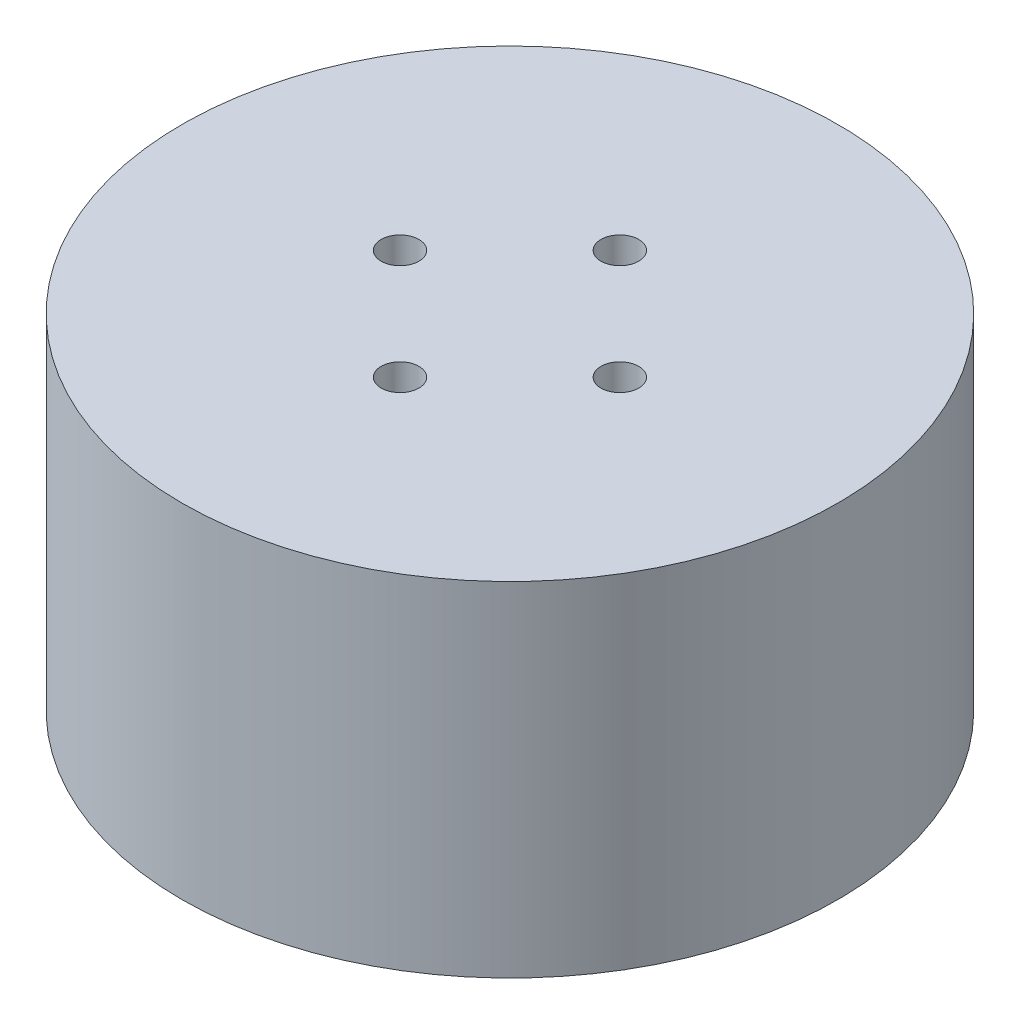
from build123d import *

# Parameters (mm, degrees)
ESQUISSE1_R              = 47.75
BOSS_EXTRU_1_DEPTH       = 50
ESQUISSE2_R              = 26
ENL_V_MAT_EXTRU_1_DEPTH  = 20
ESQUISSE3_R              = 11
ENL_V_MAT_EXTRU_5_DEPTH  = 7.5
ESQUISSE4_R              = 5
ENL_V_MAT_EXTRU_6_DEPTH  = 13.5
ESQUISSE11_R             = 2.75
ENL_V_MAT_EXTRU_11_DEPTH = 85.024549984


with BuildPart() as part:
    # Esquisse1 → Boss.-Extru.1 (new body)
    with BuildSketch(Plane(origin=(0, 0, 0), x_dir=(1, 0, 0), z_dir=(0, 1, 0))):
        with Locations(Location((0, 0, 0), (0, 0, 270))):
            Circle(ESQUISSE1_R)
    extrude(amount=BOSS_EXTRU_1_DEPTH)

    # Esquisse2 → Enlèv. mat.-Extru.1 (cut)
    with BuildSketch(Plane(origin=(0, 0, 0), x_dir=(-1, 0, 0), z_dir=(0, -1, 0))):
        with Locations(Location((0, 0, 0), (0, 0, 90))):
            Circle(ESQUISSE2_R)
    extrude(amount=-ENL_V_MAT_EXTRU_1_DEPTH, mode=Mode.SUBTRACT)

    # Esquisse3 → Enlèv. mat.-Extru.5 (cut)
    with BuildSketch(Plane(origin=(0, 20, 0), x_dir=(-1, 0, 0), z_dir=(0, -1, 0))):
        with Locations(Location((0, 0, 0), (0, 0, 90))):
            Circle(ESQUISSE3_R)
    extrude(amount=-ENL_V_MAT_EXTRU_5_DEPTH, mode=Mode.SUBTRACT)

    # Esquisse4 → Enlèv. mat.-Extru.6 (cut)
    with BuildSketch(Plane(origin=(0, 27.5, 0), x_dir=(-1, 0, 0), z_dir=(0, -1, 0))):
        with Locations(Location((0, 0, 0), (0, 0, 90))):
            Circle(ESQUISSE4_R)
    extrude(amount=-ENL_V_MAT_EXTRU_6_DEPTH, mode=Mode.SUBTRACT)

    # Esquisse11 → Enlèv. mat.-Extru.11 (cut, through all)
    with BuildSketch(Plane(origin=(0, 50, 0), x_dir=(1, 0, 0), z_dir=(0, 1, 0))):
        with Locations(Location((-16, 0, 0), (0, 0, 270))):
            Circle(ESQUISSE11_R)
        with Locations(Location((0, 16, 0), (0, 0, 270))):
            Circle(ESQUISSE11_R)
        with Locations(Location((16, 0, 0), (0, 0, 270))):
            Circle(ESQUISSE11_R)
        with Locations(Location((0, -16, 0), (0, 0, 270))):
            Circle(ESQUISSE11_R)
    extrude(amount=-ENL_V_MAT_EXTRU_11_DEPTH, mode=Mode.SUBTRACT)


solid = part.part
